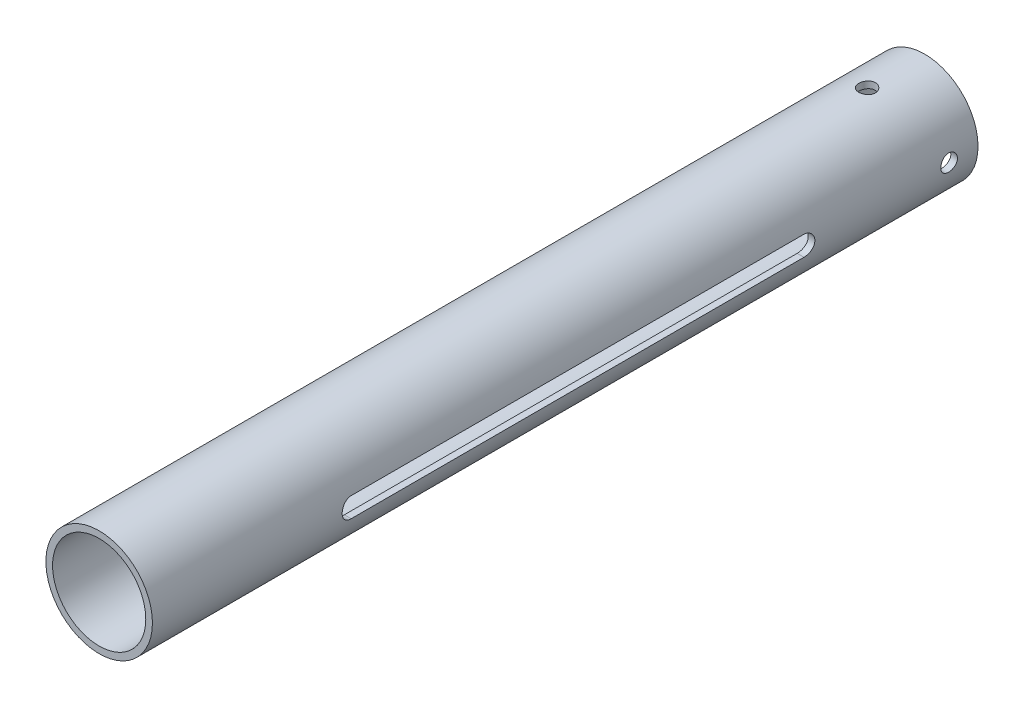
from build123d import *

# Parameters (mm, degrees)
BOSS_EXTRUDE2_DEPTH      = 152.4
BOSS_EXTRUDE2_DEPTH_BACK = 152.4
SKETCH3_R                = 25.4
SKETCH3_R_2              = 22.225
SKETCH9_R                = 25.4
SKETCH9_R_2              = 22.225
BOSS_EXTRUDE3_DEPTH      = 88.9
CUT_EXTRUDE2_DEPTH       = 244.959033446
CUT_EXTRUDE2_DEPTH_BACK  = 244.959033446
CUT_EXTRUDE3_DEPTH       = 244.959033566
CUT_EXTRUDE3_DEPTH_BACK  = 244.959033566
SKETCH6_R                = 3.96875
CUT_EXTRUDE4_DEPTH       = 244.959033566
CUT_EXTRUDE4_DEPTH_BACK  = 244.959033566
SKETCH8_R                = 3.96875


with BuildPart() as part:
    # Sketch3 → Boss-Extrude2 (new, two sides: drawn at the far end of the back side and taken through both)
    with BuildSketch(Plane.XY.offset(-BOSS_EXTRUDE2_DEPTH_BACK)):
        Circle(SKETCH3_R)
        Circle(SKETCH3_R_2, mode=Mode.SUBTRACT)
    extrude(amount=BOSS_EXTRUDE2_DEPTH + BOSS_EXTRUDE2_DEPTH_BACK)

    # Sketch9 → Boss-Extrude3 (add)
    with BuildSketch(Plane.XY.offset(152.4)):
        Circle(SKETCH9_R)
        Circle(SKETCH9_R_2, mode=Mode.SUBTRACT)
    extrude(amount=BOSS_EXTRUDE3_DEPTH)

    # Sketch5 → Cut-Extrude2 (cut, two sides: drawn at the far end of the back side and taken through both)
    with BuildSketch(Plane(origin=(0, 0, 0), x_dir=(0, 0, -1), z_dir=(1, 0, 0)).offset(-CUT_EXTRUDE2_DEPTH_BACK)):
        with BuildLine():
            Line((-146.05, 4.7625), (69.85, 4.7625))
            ThreePointArc((69.85, 4.7625), (74.6125, 0), (69.85, -4.7625))
            Line((69.85, -4.7625), (-146.05, -4.7625))
            ThreePointArc((-146.05, -4.7625), (-150.8125, 0), (-146.05, 4.7625))
        make_face()
    extrude(amount=CUT_EXTRUDE2_DEPTH + CUT_EXTRUDE2_DEPTH_BACK, mode=Mode.SUBTRACT)

    # Sketch6 → Cut-Extrude3 (cut, two sides: drawn at the far end of the back side and taken through both)
    with BuildSketch(Plane(origin=(0, 0, 0), x_dir=(0, 0, -1), z_dir=(1, 0, 0)).offset(-CUT_EXTRUDE3_DEPTH_BACK)):
        with Locations((138.641666667, 0)):
            Circle(SKETCH6_R)
    extrude(amount=CUT_EXTRUDE3_DEPTH + CUT_EXTRUDE3_DEPTH_BACK, mode=Mode.SUBTRACT)

    # Sketch8 → Cut-Extrude4 (cut, two sides: drawn at the far end of the back side and taken through both)
    with BuildSketch(Plane(origin=(0, 0, 0), x_dir=(1, 0, 0), z_dir=(0, 1, 0)).offset(-CUT_EXTRUDE4_DEPTH_BACK)):
        with Locations(Location((0, 124.883333333, 0), (0, 0, 270))):
            Circle(SKETCH8_R)
    extrude(amount=CUT_EXTRUDE4_DEPTH + CUT_EXTRUDE4_DEPTH_BACK, mode=Mode.SUBTRACT)


solid = part.part
